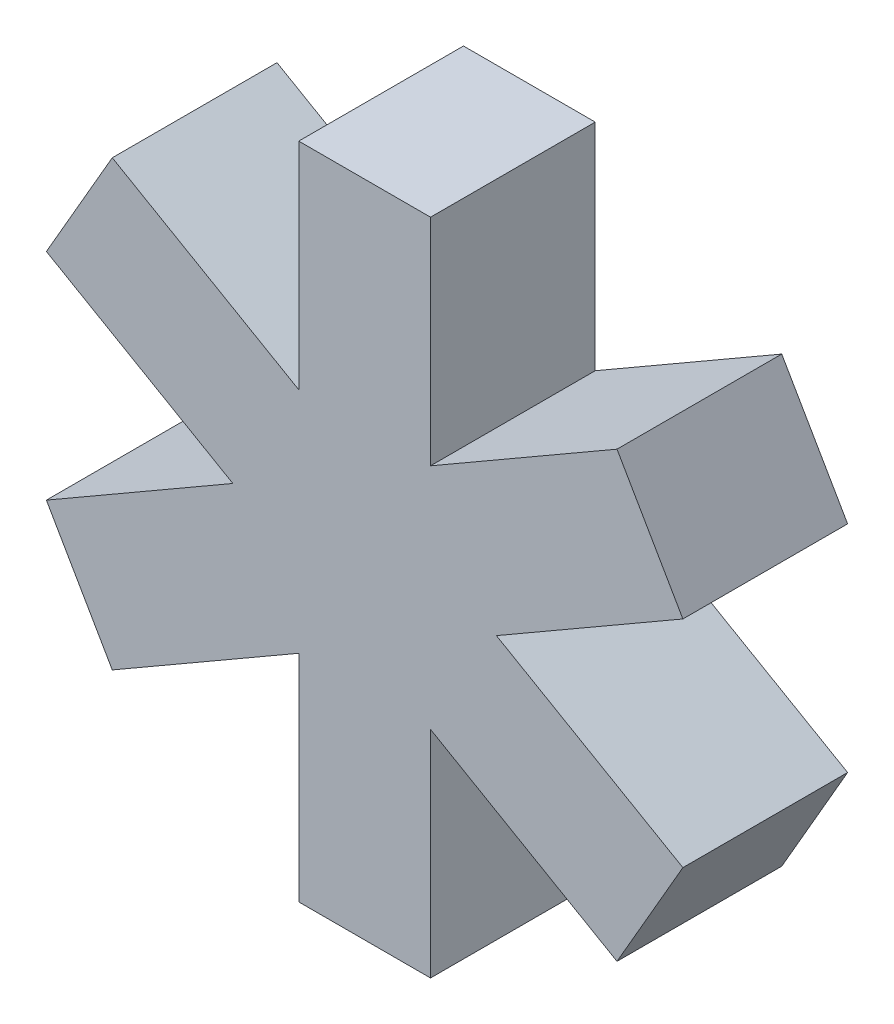
from build123d import *

# Parameters (mm, degrees)
EXTRUDE_1_DEPTH = 15


with BuildPart() as part:
    # Эскиз1 → Бобышка-Вытянуть1 (new body)
    with BuildSketch(Plane.XY):
        Polygon((-22.980762114, 20.196152423), (-28.980762114, 9.803847577), (-12, 0), (-28.980762114, -9.803847577), (-22.980762114, -20.196152423), (-6, -10.392304845), (-6, -30), (6, -30), (6, -10.392304845), (22.980762114, -20.196152423), (28.980762114, -9.803847577), (12, 0), (28.980762114, 9.803847577), (22.980762114, 20.196152423), (6, 10.392304845), (6, 30), (-6, 30), (-6, 10.392304845), align=None)
    extrude(amount=EXTRUDE_1_DEPTH)


solid = part.part
